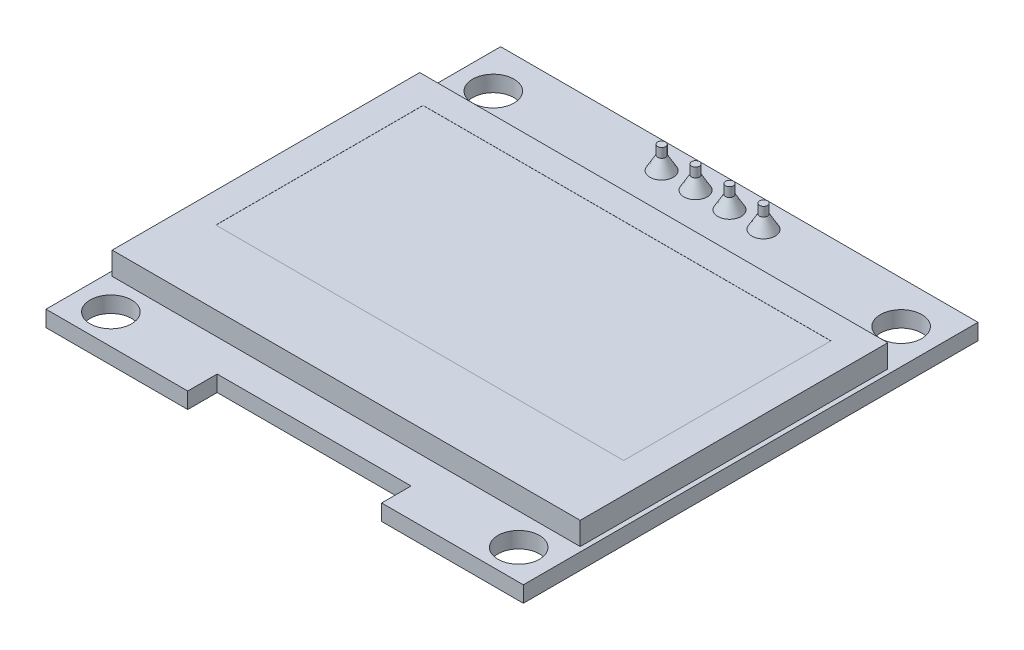
from build123d import *

# Parameters (mm, degrees)
SKIZZE1_W                                 = 35.7
SKIZZE1_H                                 = 34
AUFSATZ_LINEAR_AUSTRAGEN1_DEPTH           = 1.2
SKIZZE2_R                                 = 1.55
SCHNITT_LINEAR_AUSTRAGEN1_DEPTH           = 25.67919164
SKIZZE3_W                                 = 35
SKIZZE3_H                                 = 23
AUFSATZ_LINEAR_AUSTRAGEN2_DEPTH           = 1.7
SKIZZE4_W                                 = 30.5
SKIZZE4_H                                 = 15.5
SCHNITT_LINEAR_AUSTRAGEN2_DEPTH           = 0.01
SKIZZE5_W                                 = 14.5
SKIZZE5_H                                 = 2.2
SCHNITT_LINEAR_AUSTRAGEN3_DEPTH           = 25.708551151
SKIZZE6_R                                 = 0.875
AUFSATZ_LINEAR_AUSTRAGEN3_DEPTH           = 1
AUFSATZ_LINEAR_AUSTRAGEN3_DRAFT           = 30
AUFSATZ_LINEAR_AUSTRAGEN3_PROFILE_2_DEPTH = 1
AUFSATZ_LINEAR_AUSTRAGEN3_PROFILE_2_DRAFT = 30
AUFSATZ_LINEAR_AUSTRAGEN3_PROFILE_3_DEPTH = 1
AUFSATZ_LINEAR_AUSTRAGEN3_PROFILE_3_DRAFT = 30
AUFSATZ_LINEAR_AUSTRAGEN3_PROFILE_4_DEPTH = 1
AUFSATZ_LINEAR_AUSTRAGEN3_PROFILE_4_DRAFT = 30
SKIZZE7_R                                 = 0.297649731
AUFSATZ_LINEAR_AUSTRAGEN4_DEPTH           = 0.7
AUFSATZ_LINEAR_START                      = 8.5
SKIZZE8_R                                 = 0.297649731
AUFSATZ_LINEAR_AUSTRAGEN5_DEPTH           = 8.5
SKIZZE9_W                                 = 10.1
SKIZZE9_H                                 = 2.54
AUFSATZ_LINEAR_AUSTRAGEN6_DEPTH           = 1.8


with BuildPart() as part:
    # Skizze1 → Aufsatz-Linear austragen1 (new body)
    with BuildSketch(Plane(origin=(0, 0, 0), x_dir=(1, 0, 0), z_dir=(0, 1, 0))):
        Rectangle(SKIZZE1_W, SKIZZE1_H)
    extrude(amount=AUFSATZ_LINEAR_AUSTRAGEN1_DEPTH)

    # Skizze2 → Schnitt-Linear austragen1 (cut, through all)
    with BuildSketch(Plane(origin=(0, 1.2, 0), x_dir=(1, 0, 0), z_dir=(0, 1, 0))):
        with Locations(Location((-15.25, 13.85, 0), (0, 0, 270))):
            Circle(SKIZZE2_R)
        with Locations(Location((15.25, 13.85, 0), (0, 0, 270))):
            Circle(SKIZZE2_R)
        with Locations(Location((15.25, -14.75, 0), (0, 0, 270))):
            Circle(SKIZZE2_R)
        with Locations(Location((-15.25, -14.75, 0), (0, 0, 270))):
            Circle(SKIZZE2_R)
    extrude(amount=-SCHNITT_LINEAR_AUSTRAGEN1_DEPTH, mode=Mode.SUBTRACT)

    # Skizze3 → Aufsatz-Linear austragen2 (add)
    with BuildSketch(Plane(origin=(0, 1.2, 0), x_dir=(1, 0, 0), z_dir=(0, 1, 0))):
        with Locations((0, -0.9)):
            Rectangle(SKIZZE3_W, SKIZZE3_H)
    extrude(amount=AUFSATZ_LINEAR_AUSTRAGEN2_DEPTH)

    # Skizze4 → Schnitt-Linear austragen2 (cut)
    with BuildSketch(Plane(origin=(0, 2.9, 0), x_dir=(1, 0, 0), z_dir=(0, 1, 0))):
        with Locations((0, 0.85)):
            Rectangle(SKIZZE4_W, SKIZZE4_H)
    extrude(amount=-SCHNITT_LINEAR_AUSTRAGEN2_DEPTH, mode=Mode.SUBTRACT)

    # Skizze5 → Schnitt-Linear austragen3 (cut, through all)
    with BuildSketch(Plane(origin=(0, 1.2, 0), x_dir=(1, 0, 0), z_dir=(0, 1, 0))):
        with Locations((0, -15.9)):
            Rectangle(SKIZZE5_W, SKIZZE5_H)
    extrude(amount=-SCHNITT_LINEAR_AUSTRAGEN3_DEPTH, mode=Mode.SUBTRACT)


with BuildPart() as aufsatz_linear_austragen3_tool:
    # Skizze6 → Aufsatz-Linear austragen3 (with draft: the straight prism first)
    with BuildSketch(Plane(origin=(0, 1.2, 0), x_dir=(1, 0, 0), z_dir=(0, 1, 0))):
        with Locations((-3.81, 15)):
            Circle(SKIZZE6_R)
    extrude(amount=AUFSATZ_LINEAR_AUSTRAGEN3_DEPTH)
    # Aufsatz-Linear austragen3: the draft: its side faces are tilted about the plane it starts from
    aufsatz_linear_austragen3_sides = [aufsatz_linear_austragen3_tool.faces().sort_by_distance(p)[0] for p in [
        (-4.685, 1.7, -15),
    ]]
    draft(aufsatz_linear_austragen3_sides, Plane(origin=(0, 1.2, 0), x_dir=(1, 0, 0), z_dir=(0, 1, 0)), AUFSATZ_LINEAR_AUSTRAGEN3_DRAFT)


with BuildPart() as part_1:
    add(part.part)

    # Aufsatz-Linear austragen3: add aufsatz_linear_austragen3_tool
    add(aufsatz_linear_austragen3_tool.part)


with BuildPart() as aufsatz_linear_austragen3_profile_2_tool:
    # Skizze6 → Aufsatz-Linear austragen3 profile 2 (with draft: the straight prism first)
    with BuildSketch(Plane(origin=(0, 1.2, 0), x_dir=(1, 0, 0), z_dir=(0, 1, 0))):
        with Locations((3.81, 15)):
            Circle(SKIZZE6_R)
    extrude(amount=AUFSATZ_LINEAR_AUSTRAGEN3_PROFILE_2_DEPTH)
    # Aufsatz-Linear austragen3 profile 2: the draft: its side faces are tilted about the plane it starts from
    aufsatz_linear_austragen3_profile_2_sides = [aufsatz_linear_austragen3_profile_2_tool.faces().sort_by_distance(p)[0] for p in [
        (2.935, 1.7, -15),
    ]]
    draft(aufsatz_linear_austragen3_profile_2_sides, Plane(origin=(0, 1.2, 0), x_dir=(1, 0, 0), z_dir=(0, 1, 0)), AUFSATZ_LINEAR_AUSTRAGEN3_PROFILE_2_DRAFT)


with BuildPart() as part_2:
    add(part_1.part)

    # Aufsatz-Linear austragen3 profile 2: add aufsatz_linear_austragen3_profile_2_tool
    add(aufsatz_linear_austragen3_profile_2_tool.part)


with BuildPart() as aufsatz_linear_austragen3_profile_3_tool:
    # Skizze6 → Aufsatz-Linear austragen3 profile 3 (with draft: the straight prism first)
    with BuildSketch(Plane(origin=(0, 1.2, 0), x_dir=(1, 0, 0), z_dir=(0, 1, 0))):
        with Locations((1.27, 15)):
            Circle(SKIZZE6_R)
    extrude(amount=AUFSATZ_LINEAR_AUSTRAGEN3_PROFILE_3_DEPTH)
    # Aufsatz-Linear austragen3 profile 3: the draft: its side faces are tilted about the plane it starts from
    aufsatz_linear_austragen3_profile_3_sides = [aufsatz_linear_austragen3_profile_3_tool.faces().sort_by_distance(p)[0] for p in [
        (0.395, 1.7, -15),
    ]]
    draft(aufsatz_linear_austragen3_profile_3_sides, Plane(origin=(0, 1.2, 0), x_dir=(1, 0, 0), z_dir=(0, 1, 0)), AUFSATZ_LINEAR_AUSTRAGEN3_PROFILE_3_DRAFT)


with BuildPart() as part_3:
    add(part_2.part)

    # Aufsatz-Linear austragen3 profile 3: add aufsatz_linear_austragen3_profile_3_tool
    add(aufsatz_linear_austragen3_profile_3_tool.part)


with BuildPart() as aufsatz_linear_austragen3_profile_4_tool:
    # Skizze6 → Aufsatz-Linear austragen3 profile 4 (with draft: the straight prism first)
    with BuildSketch(Plane(origin=(0, 1.2, 0), x_dir=(1, 0, 0), z_dir=(0, 1, 0))):
        with Locations((-1.27, 15)):
            Circle(SKIZZE6_R)
    extrude(amount=AUFSATZ_LINEAR_AUSTRAGEN3_PROFILE_4_DEPTH)
    # Aufsatz-Linear austragen3 profile 4: the draft: its side faces are tilted about the plane it starts from
    aufsatz_linear_austragen3_profile_4_sides = [aufsatz_linear_austragen3_profile_4_tool.faces().sort_by_distance(p)[0] for p in [
        (-2.145, 1.7, -15),
    ]]
    draft(aufsatz_linear_austragen3_profile_4_sides, Plane(origin=(0, 1.2, 0), x_dir=(1, 0, 0), z_dir=(0, 1, 0)), AUFSATZ_LINEAR_AUSTRAGEN3_PROFILE_4_DRAFT)


with BuildPart() as part_4:
    add(part_3.part)

    # Aufsatz-Linear austragen3 profile 4: add aufsatz_linear_austragen3_profile_4_tool
    add(aufsatz_linear_austragen3_profile_4_tool.part)

    # Skizze7 → Aufsatz-Linear austragen4 (add)
    with BuildSketch(Plane(origin=(0, 2.2, 0), x_dir=(1, 0, 0), z_dir=(0, 1, 0))):
        with Locations(Location((-3.81, 15, 0), (0, 0, 270))):
            Circle(SKIZZE7_R)
        with Locations(Location((-1.27, 15, 0), (0, 0, 270))):
            Circle(SKIZZE7_R)
        with Locations(Location((1.27, 15, 0), (0, 0, 270))):
            Circle(SKIZZE7_R)
        with Locations(Location((3.81, 15, 0), (0, 0, 270))):
            Circle(SKIZZE7_R)
    extrude(amount=AUFSATZ_LINEAR_AUSTRAGEN4_DEPTH)

    # Skizze8 → Aufsatz-Linear austragen5 (add)
    with BuildSketch(Plane.XZ.offset(AUFSATZ_LINEAR_START)):
        with Locations(Location((-1.27, -15, 0), (0, 0, 90))):
            Circle(SKIZZE8_R)
        with Locations(Location((-3.81, -15, 0), (0, 0, 90))):
            Circle(SKIZZE8_R)
        with Locations(Location((1.27, -15, 0), (0, 0, 90))):
            Circle(SKIZZE8_R)
        with Locations(Location((3.81, -15, 0), (0, 0, 90))):
            Circle(SKIZZE8_R)
    extrude(amount=-AUFSATZ_LINEAR_AUSTRAGEN5_DEPTH)


with BuildPart() as body_2:
    # Skizze9 → Aufsatz-Linear austragen6 (new body)
    with BuildSketch(Plane.XZ):
        with Locations((0, -15)):
            Rectangle(SKIZZE9_W, SKIZZE9_H)
    extrude(amount=AUFSATZ_LINEAR_AUSTRAGEN6_DEPTH)


solid = Compound([part_4.part, body_2.part])
